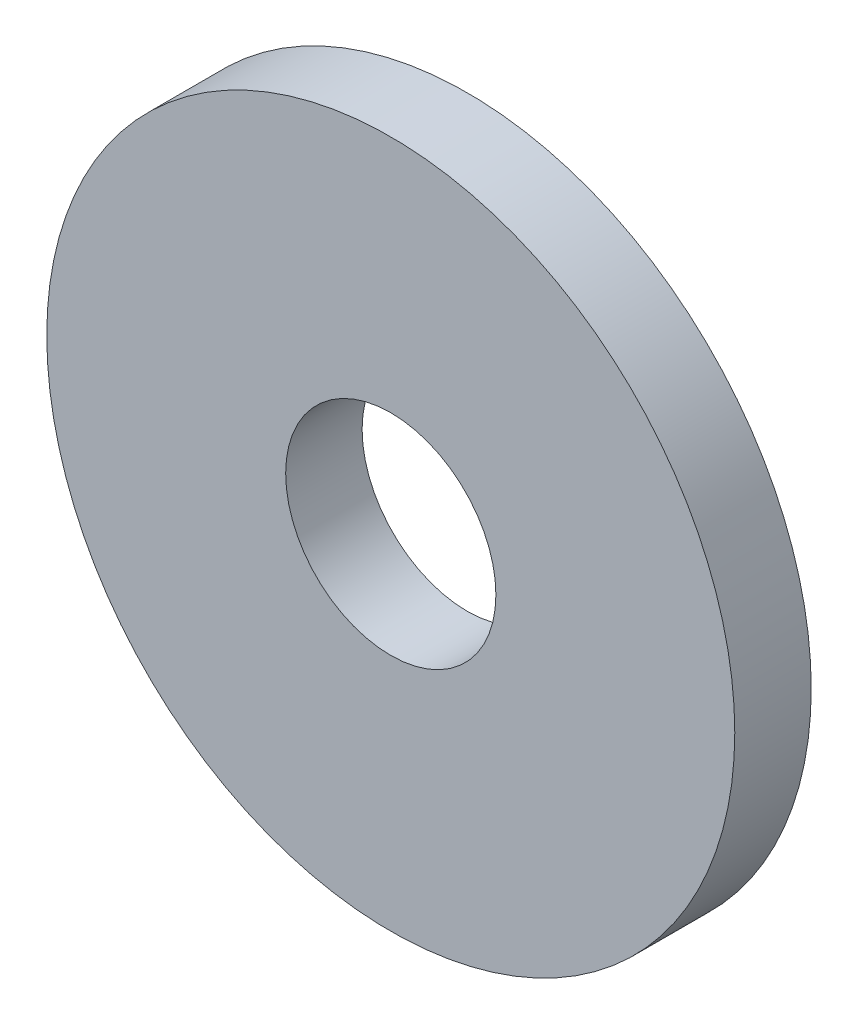
from build123d import *

# Parameters (mm, degrees)
MODEL_R             = 9
MODEL_R_2           = 2.75
BOSS_EXTRUDE1_DEPTH = 2


with BuildPart() as part:
    # Model → Boss-Extrude1 (new body)
    with BuildSketch(Plane.XY):
        with Locations((1974.695627724, 1141.241784538)):
            Circle(MODEL_R)
        with Locations((1974.695627724, 1141.241784538)):
            Circle(MODEL_R_2, mode=Mode.SUBTRACT)
    extrude(amount=BOSS_EXTRUDE1_DEPTH)


solid = part.part
